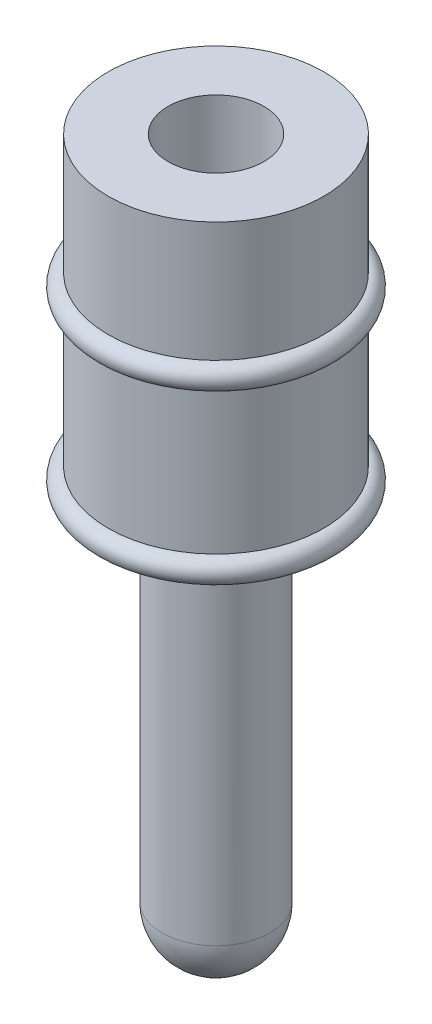
from build123d import *


with BuildPart() as part:
    # Skizze1 → Rotation1 (revolve)
    with BuildSketch(Plane.XY, mode=Mode.PRIVATE) as rotation1_sk:
        with BuildLine():
            Line((-2.25, 15), (-2.25, 8.5))
            Line((-2.25, 8.5), (-1.125, 8))
            Line((-1.125, 8), (-1.125, 1.125))
            ThreePointArc((-1.125, 1.125), (-0.795495129, 0.329504871), (0, 0))
            Line((0, 0), (0, 15))
            Line((0, 15), (-2.25, 15))
        make_face()
    revolve(rotation1_sk.sketch.rotate(Axis((0, 0, 0), (0, 1, 0)), 270), axis=Axis((0, 0, 0), (0, 1, 0)))

    # Skizze2 → Schnitt-Rotation1 (revolve, cut)
    with BuildSketch(Plane.XY):
        Polygon((0, 15), (0, 11), (-1.375, 11), (-1.375, 13), (-1, 13), (-1, 15), align=None)
    revolve(axis=Axis((0, 15, 0), (0, -1, 0)), mode=Mode.SUBTRACT)

    # Skizze3 → Rotation2 (revolve)
    with BuildSketch(Plane.XY, mode=Mode.PRIVATE) as rotation2_sk:
        with BuildLine():
            Line((-2.25, 12.5), (-2.25, 12))
            ThreePointArc((-2.25, 12), (-2.5, 12.25), (-2.25, 12.5))
        make_face()
        with BuildLine():
            Line((-2.25, 9), (-2.25, 8.5))
            ThreePointArc((-2.25, 8.5), (-2.5, 8.75), (-2.25, 9))
        make_face()
    revolve(rotation2_sk.sketch.rotate(Axis((0, 0, 0), (0, 1, 0)), 270), axis=Axis((0, 0, 0), (0, 1, 0)))


solid = part.part
